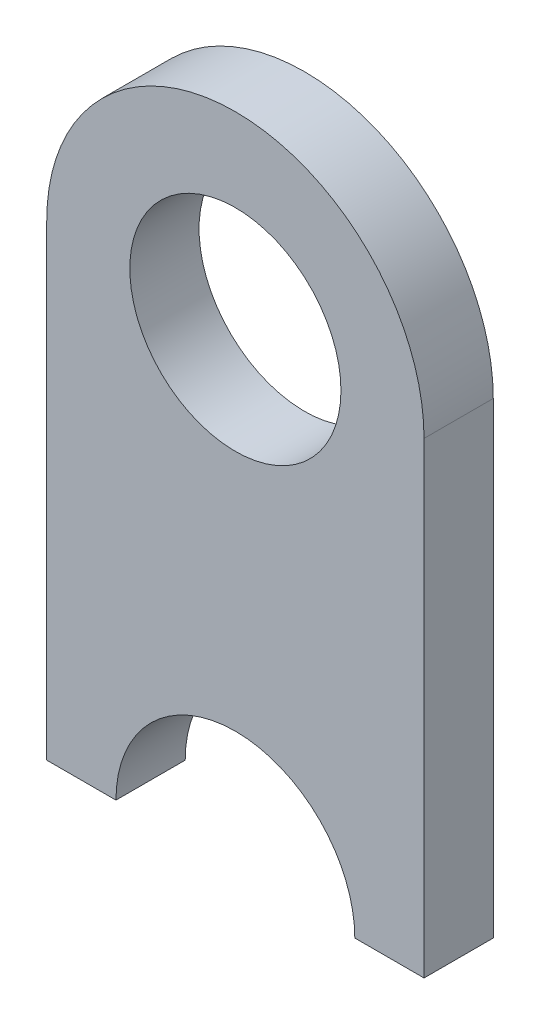
from build123d import *

# Parameters (mm, degrees)
SKETCH_1_R      = 6.1
EXTRUDE_1_DEPTH = 4


with BuildPart() as part:
    # 스케치1 → 보스-돌출1 (new body)
    with BuildSketch(Plane.XY):
        with BuildLine():
            Line((-10.9, 20.333989173), (-10.9, -6.666010827))
            Line((-10.9, -6.666010827), (-8.65, -6.666010827))
            Line((-8.65, -6.666010827), (-6.9, -6.666010827))
            ThreePointArc((-6.9, -6.666010827), (0, 0.233989173), (6.9, -6.666010827))
            Line((6.9, -6.666010827), (8.65, -6.666010827))
            Line((8.65, -6.666010827), (10.9, -6.666010827))
            Line((10.9, -6.666010827), (10.9, 20.333989173))
            ThreePointArc((10.9, 20.333989173), (0, 31.233989173), (-10.9, 20.333989173))
        make_face()
        with Locations((0, 20.333989173)):
            Circle(SKETCH_1_R, mode=Mode.SUBTRACT)
    extrude(amount=EXTRUDE_1_DEPTH)


solid = part.part
